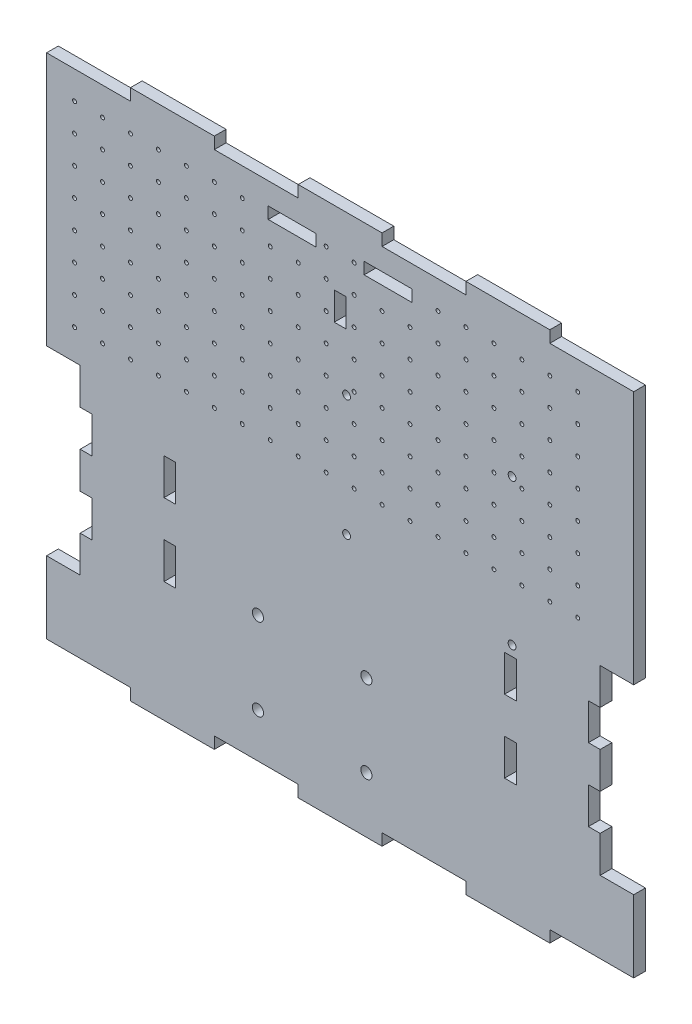
from build123d import *

# Parameters (mm, degrees)
SKETCH1_W           = 266.7
SKETCH1_H           = 241.3
BOSS_EXTRUDE1_DEPTH = 5.334
SKETCH2_W           = 15.24
SKETCH2_H           = 82.55
CUT_EXTRUDE1_DEPTH  = 180.908578328
SKETCH9_W           = 5.334
SKETCH9_H           = 16.51
CUT_EXTRUDE2_DEPTH  = 180.908578328
SKETCH10_R          = 2.54
CUT_EXTRUDE3_DEPTH  = 180.908578328
SKETCH23_W          = 5.334
SKETCH23_H          = 16.51
CUT_EXTRUDE8_DEPTH  = 180.908578328
SKETCH19_W          = 21.791696412
SKETCH19_H          = 5.334
CUT_EXTRUDE9_DEPTH  = 180.908578328
SKETCH19_5_W        = 21.791696412
SKETCH19_5_H        = 5.334
CUT_EXTRUDE11_DEPTH = 180.908578328
SKETCH27_W          = 5.334
SKETCH27_H          = 12.7
CUT_EXTRUDE12_DEPTH = 180.908578328
SKETCH28_W          = 38.1
SKETCH28_H          = 5.334
CUT_EXTRUDE13_DEPTH = 180.908578328
SKETCH29_W          = 38.1
SKETCH29_H          = 5.334
CUT_EXTRUDE14_DEPTH = 180.908578328
SKETCH30_R          = 0.889
CUT_EXTRUDE15_DEPTH = 180.908578328
SKETCH32_R          = 1.778
CUT_EXTRUDE16_DEPTH = 180.908578328


with BuildPart() as part:
    # Sketch1 → Boss-Extrude1 (new body)
    with BuildSketch(Plane.XY):
        Rectangle(SKETCH1_W, SKETCH1_H)
    extrude(amount=BOSS_EXTRUDE1_DEPTH)

    # Sketch2 → Cut-Extrude1 (cut, through all)
    with BuildSketch(Plane(origin=(0, 0, 0), x_dir=(-1, 0, 0), z_dir=(0, 0, -1))):
        with Locations((125.73, -41.275)):
            Rectangle(SKETCH2_W, SKETCH2_H)
        with Locations((-125.73, -41.275)):
            Rectangle(SKETCH2_W, SKETCH2_H)
    extrude(amount=-CUT_EXTRUDE1_DEPTH, mode=Mode.SUBTRACT)

    # Sketch9 → Cut-Extrude2 (cut, through all)
    with BuildSketch(Plane.XY.offset(5.334)):
        with Locations((-115.443, -24.765)):
            Rectangle(SKETCH9_W, SKETCH9_H)
        with Locations((-115.443, -57.785)):
            Rectangle(SKETCH9_W, SKETCH9_H)
        with Locations((115.443, -57.785)):
            Rectangle(SKETCH9_W, SKETCH9_H)
        with Locations((115.443, -24.765)):
            Rectangle(SKETCH9_W, SKETCH9_H)
    extrude(amount=-CUT_EXTRUDE2_DEPTH, mode=Mode.SUBTRACT)

    # Sketch10 → Cut-Extrude3 (cut, through all)
    with BuildSketch(Plane.XY.offset(5.334)):
        with Locations((-37.338, -95.25)):
            Circle(SKETCH10_R)
        with Locations((11.938, -95.25)):
            Circle(SKETCH10_R)
        with Locations((11.938, -57.912)):
            Circle(SKETCH10_R)
        with Locations((-37.338, -57.912)):
            Circle(SKETCH10_R)
    extrude(amount=-CUT_EXTRUDE3_DEPTH, mode=Mode.SUBTRACT)

    # Sketch23 → Cut-Extrude8 (cut, through all)
    with BuildSketch(Plane.XY.offset(5.334)):
        with Locations((-77.343, -57.785)):
            Rectangle(SKETCH23_W, SKETCH23_H)
        with Locations((77.343, -24.765)):
            Rectangle(SKETCH23_W, SKETCH23_H)
        with Locations((77.343, -57.785)):
            Rectangle(SKETCH23_W, SKETCH23_H)
        with Locations((-77.343, -24.765)):
            Rectangle(SKETCH23_W, SKETCH23_H)
    extrude(amount=-CUT_EXTRUDE8_DEPTH, mode=Mode.SUBTRACT)

    # Sketch19 → Cut-Extrude9 (cut, through all)
    with BuildSketch(Plane.XY.offset(5.334)):
        with Locations((-21.791696412, 102.743)):
            Rectangle(SKETCH19_W, SKETCH19_H)
    extrude(amount=-CUT_EXTRUDE9_DEPTH, mode=Mode.SUBTRACT)

    # Sketch19<5> → Cut-Extrude11 (cut, through all)
    with BuildSketch(Plane.XY.offset(5.334)):
        with Locations((-21.791696412, 102.743)):
            Rectangle(SKETCH19_5_W, SKETCH19_5_H)
        with Locations((21.791696412, 102.743)):
            Rectangle(SKETCH19_5_W, SKETCH19_5_H)
    extrude(amount=-CUT_EXTRUDE11_DEPTH, mode=Mode.SUBTRACT)

    # Sketch27 → Cut-Extrude12 (cut, through all)
    with BuildSketch(Plane.XY.offset(5.334)):
        with Locations((0, 81.026)):
            Rectangle(SKETCH27_W, SKETCH27_H)
    extrude(amount=-CUT_EXTRUDE12_DEPTH, mode=Mode.SUBTRACT)

    # Sketch28 → Cut-Extrude13 (cut, through all)
    with BuildSketch(Plane(origin=(0, 0, 0), x_dir=(-1, 0, 0), z_dir=(0, 0, -1))):
        with Locations((-114.3, -117.983)):
            Rectangle(SKETCH28_W, SKETCH28_H)
        with Locations((-38.1, -117.983)):
            Rectangle(SKETCH28_W, SKETCH28_H)
        with Locations((38.1, -117.983)):
            Rectangle(SKETCH28_W, SKETCH28_H)
        with Locations((114.3, -117.983)):
            Rectangle(SKETCH28_W, SKETCH28_H)
    extrude(amount=-CUT_EXTRUDE13_DEPTH, mode=Mode.SUBTRACT)

    # Sketch29 → Cut-Extrude14 (cut, through all)
    with BuildSketch(Plane(origin=(0, 0, 0), x_dir=(-1, 0, 0), z_dir=(0, 0, -1))):
        with Locations((-114.3, 117.983)):
            Rectangle(SKETCH29_W, SKETCH29_H)
        with Locations((-38.1, 117.983)):
            Rectangle(SKETCH29_W, SKETCH29_H)
        with Locations((38.1, 117.983)):
            Rectangle(SKETCH29_W, SKETCH29_H)
        with Locations((114.3, 117.983)):
            Rectangle(SKETCH29_W, SKETCH29_H)
    extrude(amount=-CUT_EXTRUDE14_DEPTH, mode=Mode.SUBTRACT)

    # Sketch30 → Cut-Extrude15 (cut, through all)
    with BuildSketch(Plane.XY.offset(5.334)):
        with Locations((-120.65, 102.616)):
            Circle(SKETCH30_R)
        with Locations((-107.95, 102.616)):
            Circle(SKETCH30_R)
        with Locations((-95.25, 102.616)):
            Circle(SKETCH30_R)
        with Locations((-82.55, 102.616)):
            Circle(SKETCH30_R)
        with Locations((-69.85, 102.616)):
            Circle(SKETCH30_R)
        with Locations((-57.15, 102.616)):
            Circle(SKETCH30_R)
        with Locations((-44.45, 102.616)):
            Circle(SKETCH30_R)
        with Locations((-6.35, 102.616)):
            Circle(SKETCH30_R)
        with Locations((6.35, 102.616)):
            Circle(SKETCH30_R)
        with Locations((44.45, 102.616)):
            Circle(SKETCH30_R)
        with Locations((57.15, 102.616)):
            Circle(SKETCH30_R)
        with Locations((69.85, 102.616)):
            Circle(SKETCH30_R)
        with Locations((82.55, 102.616)):
            Circle(SKETCH30_R)
        with Locations((95.25, 102.616)):
            Circle(SKETCH30_R)
        with Locations((107.95, 102.616)):
            Circle(SKETCH30_R)
        with Locations((-107.95, 89.916)):
            Circle(SKETCH30_R)
        with Locations((-95.25, 89.916)):
            Circle(SKETCH30_R)
        with Locations((-82.55, 89.916)):
            Circle(SKETCH30_R)
        with Locations((-69.85, 89.916)):
            Circle(SKETCH30_R)
        with Locations((-57.15, 89.916)):
            Circle(SKETCH30_R)
        with Locations((-44.45, 89.916)):
            Circle(SKETCH30_R)
        with Locations((-31.75, 89.916)):
            Circle(SKETCH30_R)
        with Locations((-19.05, 89.916)):
            Circle(SKETCH30_R)
        with Locations((-6.35, 89.916)):
            Circle(SKETCH30_R)
        with Locations((6.35, 89.916)):
            Circle(SKETCH30_R)
        with Locations((19.05, 89.916)):
            Circle(SKETCH30_R)
        with Locations((31.75, 89.916)):
            Circle(SKETCH30_R)
        with Locations((44.45, 89.916)):
            Circle(SKETCH30_R)
        with Locations((57.15, 89.916)):
            Circle(SKETCH30_R)
        with Locations((69.85, 89.916)):
            Circle(SKETCH30_R)
        with Locations((82.55, 89.916)):
            Circle(SKETCH30_R)
        with Locations((95.25, 89.916)):
            Circle(SKETCH30_R)
        with Locations((107.95, 89.916)):
            Circle(SKETCH30_R)
        with Locations((-107.95, 77.216)):
            Circle(SKETCH30_R)
        with Locations((-95.25, 77.216)):
            Circle(SKETCH30_R)
        with Locations((-82.55, 77.216)):
            Circle(SKETCH30_R)
        with Locations((-69.85, 77.216)):
            Circle(SKETCH30_R)
        with Locations((-57.15, 77.216)):
            Circle(SKETCH30_R)
        with Locations((-44.45, 77.216)):
            Circle(SKETCH30_R)
        with Locations((-31.75, 77.216)):
            Circle(SKETCH30_R)
        with Locations((-19.05, 77.216)):
            Circle(SKETCH30_R)
        with Locations((-6.35, 77.216)):
            Circle(SKETCH30_R)
        with Locations((6.35, 77.216)):
            Circle(SKETCH30_R)
        with Locations((19.05, 77.216)):
            Circle(SKETCH30_R)
        with Locations((31.75, 77.216)):
            Circle(SKETCH30_R)
        with Locations((44.45, 77.216)):
            Circle(SKETCH30_R)
        with Locations((57.15, 77.216)):
            Circle(SKETCH30_R)
        with Locations((69.85, 77.216)):
            Circle(SKETCH30_R)
        with Locations((82.55, 77.216)):
            Circle(SKETCH30_R)
        with Locations((95.25, 77.216)):
            Circle(SKETCH30_R)
        with Locations((107.95, 77.216)):
            Circle(SKETCH30_R)
        with Locations((-107.95, 64.516)):
            Circle(SKETCH30_R)
        with Locations((-95.25, 64.516)):
            Circle(SKETCH30_R)
        with Locations((-82.55, 64.516)):
            Circle(SKETCH30_R)
        with Locations((-69.85, 64.516)):
            Circle(SKETCH30_R)
        with Locations((-57.15, 64.516)):
            Circle(SKETCH30_R)
        with Locations((-44.45, 64.516)):
            Circle(SKETCH30_R)
        with Locations((-31.75, 64.516)):
            Circle(SKETCH30_R)
        with Locations((-19.05, 64.516)):
            Circle(SKETCH30_R)
        with Locations((-6.35, 64.516)):
            Circle(SKETCH30_R)
        with Locations((6.35, 64.516)):
            Circle(SKETCH30_R)
        with Locations((19.05, 64.516)):
            Circle(SKETCH30_R)
        with Locations((31.75, 64.516)):
            Circle(SKETCH30_R)
        with Locations((44.45, 64.516)):
            Circle(SKETCH30_R)
        with Locations((57.15, 64.516)):
            Circle(SKETCH30_R)
        with Locations((69.85, 64.516)):
            Circle(SKETCH30_R)
        with Locations((82.55, 64.516)):
            Circle(SKETCH30_R)
        with Locations((95.25, 64.516)):
            Circle(SKETCH30_R)
        with Locations((107.95, 64.516)):
            Circle(SKETCH30_R)
        with Locations((-107.95, 51.816)):
            Circle(SKETCH30_R)
        with Locations((-95.25, 51.816)):
            Circle(SKETCH30_R)
        with Locations((-82.55, 51.816)):
            Circle(SKETCH30_R)
        with Locations((-69.85, 51.816)):
            Circle(SKETCH30_R)
        with Locations((-57.15, 51.816)):
            Circle(SKETCH30_R)
        with Locations((-44.45, 51.816)):
            Circle(SKETCH30_R)
        with Locations((-31.75, 51.816)):
            Circle(SKETCH30_R)
        with Locations((-19.05, 51.816)):
            Circle(SKETCH30_R)
        with Locations((-6.35, 51.816)):
            Circle(SKETCH30_R)
        with Locations((6.35, 51.816)):
            Circle(SKETCH30_R)
        with Locations((19.05, 51.816)):
            Circle(SKETCH30_R)
        with Locations((31.75, 51.816)):
            Circle(SKETCH30_R)
        with Locations((44.45, 51.816)):
            Circle(SKETCH30_R)
        with Locations((57.15, 51.816)):
            Circle(SKETCH30_R)
        with Locations((69.85, 51.816)):
            Circle(SKETCH30_R)
        with Locations((82.55, 51.816)):
            Circle(SKETCH30_R)
        with Locations((95.25, 51.816)):
            Circle(SKETCH30_R)
        with Locations((107.95, 51.816)):
            Circle(SKETCH30_R)
        with Locations((-107.95, 39.116)):
            Circle(SKETCH30_R)
        with Locations((-95.25, 39.116)):
            Circle(SKETCH30_R)
        with Locations((-82.55, 39.116)):
            Circle(SKETCH30_R)
        with Locations((-69.85, 39.116)):
            Circle(SKETCH30_R)
        with Locations((-57.15, 39.116)):
            Circle(SKETCH30_R)
        with Locations((-44.45, 39.116)):
            Circle(SKETCH30_R)
        with Locations((-31.75, 39.116)):
            Circle(SKETCH30_R)
        with Locations((-19.05, 39.116)):
            Circle(SKETCH30_R)
        with Locations((-6.35, 39.116)):
            Circle(SKETCH30_R)
        with Locations((6.35, 39.116)):
            Circle(SKETCH30_R)
        with Locations((19.05, 39.116)):
            Circle(SKETCH30_R)
        with Locations((31.75, 39.116)):
            Circle(SKETCH30_R)
        with Locations((44.45, 39.116)):
            Circle(SKETCH30_R)
        with Locations((57.15, 39.116)):
            Circle(SKETCH30_R)
        with Locations((69.85, 39.116)):
            Circle(SKETCH30_R)
        with Locations((82.55, 39.116)):
            Circle(SKETCH30_R)
        with Locations((95.25, 39.116)):
            Circle(SKETCH30_R)
        with Locations((107.95, 39.116)):
            Circle(SKETCH30_R)
        with Locations((-107.95, 26.416)):
            Circle(SKETCH30_R)
        with Locations((-95.25, 26.416)):
            Circle(SKETCH30_R)
        with Locations((-82.55, 26.416)):
            Circle(SKETCH30_R)
        with Locations((-69.85, 26.416)):
            Circle(SKETCH30_R)
        with Locations((-57.15, 26.416)):
            Circle(SKETCH30_R)
        with Locations((-44.45, 26.416)):
            Circle(SKETCH30_R)
        with Locations((-31.75, 26.416)):
            Circle(SKETCH30_R)
        with Locations((-19.05, 26.416)):
            Circle(SKETCH30_R)
        with Locations((-6.35, 26.416)):
            Circle(SKETCH30_R)
        with Locations((6.35, 26.416)):
            Circle(SKETCH30_R)
        with Locations((19.05, 26.416)):
            Circle(SKETCH30_R)
        with Locations((31.75, 26.416)):
            Circle(SKETCH30_R)
        with Locations((44.45, 26.416)):
            Circle(SKETCH30_R)
        with Locations((57.15, 26.416)):
            Circle(SKETCH30_R)
        with Locations((69.85, 26.416)):
            Circle(SKETCH30_R)
        with Locations((82.55, 26.416)):
            Circle(SKETCH30_R)
        with Locations((95.25, 26.416)):
            Circle(SKETCH30_R)
        with Locations((107.95, 26.416)):
            Circle(SKETCH30_R)
        with Locations((-107.95, 13.716)):
            Circle(SKETCH30_R)
        with Locations((-95.25, 13.716)):
            Circle(SKETCH30_R)
        with Locations((-82.55, 13.716)):
            Circle(SKETCH30_R)
        with Locations((-69.85, 13.716)):
            Circle(SKETCH30_R)
        with Locations((-57.15, 13.716)):
            Circle(SKETCH30_R)
        with Locations((-44.45, 13.716)):
            Circle(SKETCH30_R)
        with Locations((-31.75, 13.716)):
            Circle(SKETCH30_R)
        with Locations((-19.05, 13.716)):
            Circle(SKETCH30_R)
        with Locations((-6.35, 13.716)):
            Circle(SKETCH30_R)
        with Locations((6.35, 13.716)):
            Circle(SKETCH30_R)
        with Locations((19.05, 13.716)):
            Circle(SKETCH30_R)
        with Locations((31.75, 13.716)):
            Circle(SKETCH30_R)
        with Locations((44.45, 13.716)):
            Circle(SKETCH30_R)
        with Locations((57.15, 13.716)):
            Circle(SKETCH30_R)
        with Locations((69.85, 13.716)):
            Circle(SKETCH30_R)
        with Locations((82.55, 13.716)):
            Circle(SKETCH30_R)
        with Locations((95.25, 13.716)):
            Circle(SKETCH30_R)
        with Locations((107.95, 13.716)):
            Circle(SKETCH30_R)
        with Locations((-120.65, 89.916)):
            Circle(SKETCH30_R)
        with Locations((-120.65, 77.216)):
            Circle(SKETCH30_R)
        with Locations((-120.65, 64.516)):
            Circle(SKETCH30_R)
        with Locations((-120.65, 51.816)):
            Circle(SKETCH30_R)
        with Locations((-120.65, 39.116)):
            Circle(SKETCH30_R)
        with Locations((-120.65, 26.416)):
            Circle(SKETCH30_R)
        with Locations((-120.65, 13.716)):
            Circle(SKETCH30_R)
    extrude(amount=-CUT_EXTRUDE15_DEPTH, mode=Mode.SUBTRACT)

    # Sketch32 → Cut-Extrude16 (cut, through all)
    with BuildSketch(Plane(origin=(0, 0, 0), x_dir=(-1, 0, 0), z_dir=(0, 0, -1))):
        with Locations((-78.105, -11.938)):
            Circle(SKETCH32_R)
        with Locations((-2.921, -6.096)):
            Circle(SKETCH32_R)
        with Locations((-78.105, 54.356)):
            Circle(SKETCH32_R)
        with Locations((-2.921, 48.768)):
            Circle(SKETCH32_R)
    extrude(amount=-CUT_EXTRUDE16_DEPTH, mode=Mode.SUBTRACT)


solid = part.part
